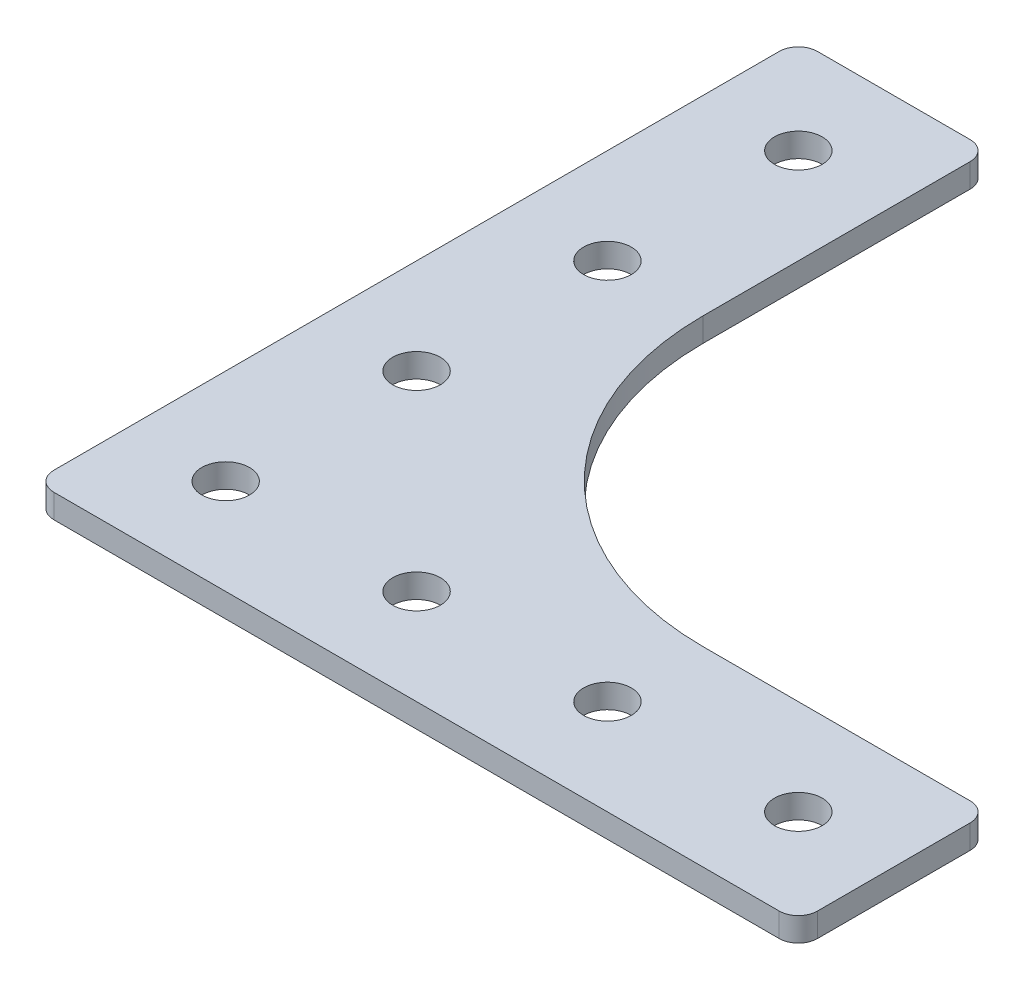
from build123d import *

# Parameters (mm, degrees)
BOSS_EXTRUDE1_DEPTH         = 3.175
F_1_4_0_25_DIAMETER_HOLE1_D = 6.35
F_1_4_0_25_DIAMETER_HOLE2_D = 6.35


with BuildPart() as part:
    # Sketch2 → Boss-Extrude1 (new body)
    with BuildSketch(Plane(origin=(0, 0, 0), x_dir=(1, 0, 0), z_dir=(0, 1, 0))):
        with BuildLine():
            Line((-431.938028743, -442.700646237), (-335.418028743, -442.700646237))
            ThreePointArc((-335.418028743, -442.700646237), (-333.621977519, -441.956697461), (-332.878028743, -440.160646237))
            Line((-332.878028743, -440.160646237), (-332.878028743, -419.840646237))
            ThreePointArc((-332.878028743, -419.840646237), (-333.621977519, -418.044595013), (-335.418028743, -417.300646237))
            Line((-335.418028743, -417.300646237), (-370.978028743, -417.300646237))
            ThreePointArc((-370.978028743, -417.300646237), (-397.918797106, -406.1414146), (-409.078028743, -379.200646237))
            Line((-409.078028743, -379.200646237), (-409.078028743, -343.640646237))
            ThreePointArc((-409.078028743, -343.640646237), (-409.821977519, -341.844595013), (-411.618028743, -341.100646237))
            Line((-411.618028743, -341.100646237), (-431.938028743, -341.100646237))
            ThreePointArc((-431.938028743, -341.100646237), (-433.734079967, -341.844595013), (-434.478028743, -343.640646237))
            Line((-434.478028743, -343.640646237), (-434.478028743, -440.160646237))
            ThreePointArc((-434.478028743, -440.160646237), (-433.734079967, -441.956697461), (-431.938028743, -442.700646237))
        make_face()
    extrude(amount=BOSS_EXTRUDE1_DEPTH)

    # 1/4 (0.25) Diameter Hole1 (through all)
    with Locations(Plane(origin=(0, 3.175, 0), x_dir=(1, 0, 0), z_dir=(0, 1, 0))):
        with Locations((-421.778028743, -353.800646237), (-421.778028743, -379.200646237), (-370.978028743, -430.000646237), (-345.578028743, -430.000646237)):
            Hole(F_1_4_0_25_DIAMETER_HOLE1_D / 2)

    # 1/4 (0.25) Diameter Hole2 (through all)
    with Locations(Plane(origin=(0, 3.175, 0), x_dir=(1, 0, 0), z_dir=(0, 1, 0))):
        with Locations((-421.778028743, -430.000646237), (-396.378028743, -430.000646237), (-421.778028743, -404.600646237)):
            Hole(F_1_4_0_25_DIAMETER_HOLE2_D / 2)


solid = part.part
